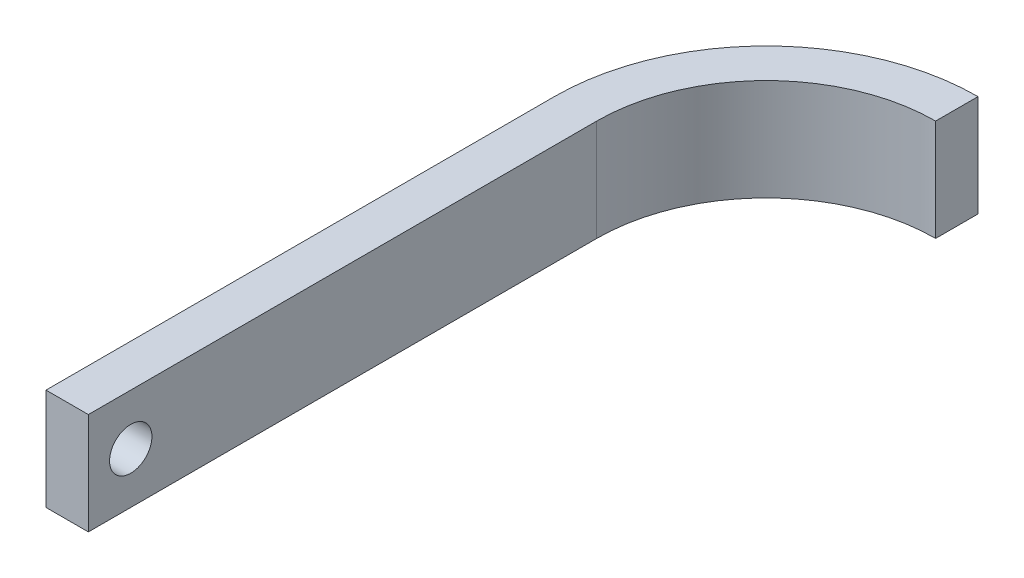
from build123d import *

# Parameters (mm, degrees)
BOSS_EXTRUDE1_DEPTH = 15.24
SKETCH2_R           = 3.175
CUT_EXTRUDE1_DEPTH  = 15.24


with BuildPart() as part:
    # Sketch1 → Boss-Extrude1 (new body)
    with BuildSketch(Plane(origin=(0, 0, 0), x_dir=(1, 0, 0), z_dir=(0, 1, 0))):
        with BuildLine():
            Line((31.75, 101.6), (31.75, 107.95))
            ThreePointArc((31.75, 107.95), (9.299359697, 98.650640303), (0, 76.2))
            Line((0, 76.2), (0, 0))
            Line((0, 0), (6.35, 0))
            Line((6.35, 0), (6.35, 76.2))
            ThreePointArc((6.35, 76.2), (13.789487758, 94.160512242), (31.75, 101.6))
        make_face()
    extrude(amount=BOSS_EXTRUDE1_DEPTH)

    # Sketch2 → Cut-Extrude1 (cut)
    with BuildSketch(Plane(origin=(6.35, 0, 0), x_dir=(0, 0, -1), z_dir=(1, 0, 0))):
        with Locations((6.35, 7.62)):
            Circle(SKETCH2_R)
    extrude(amount=-CUT_EXTRUDE1_DEPTH, mode=Mode.SUBTRACT)


solid = part.part
